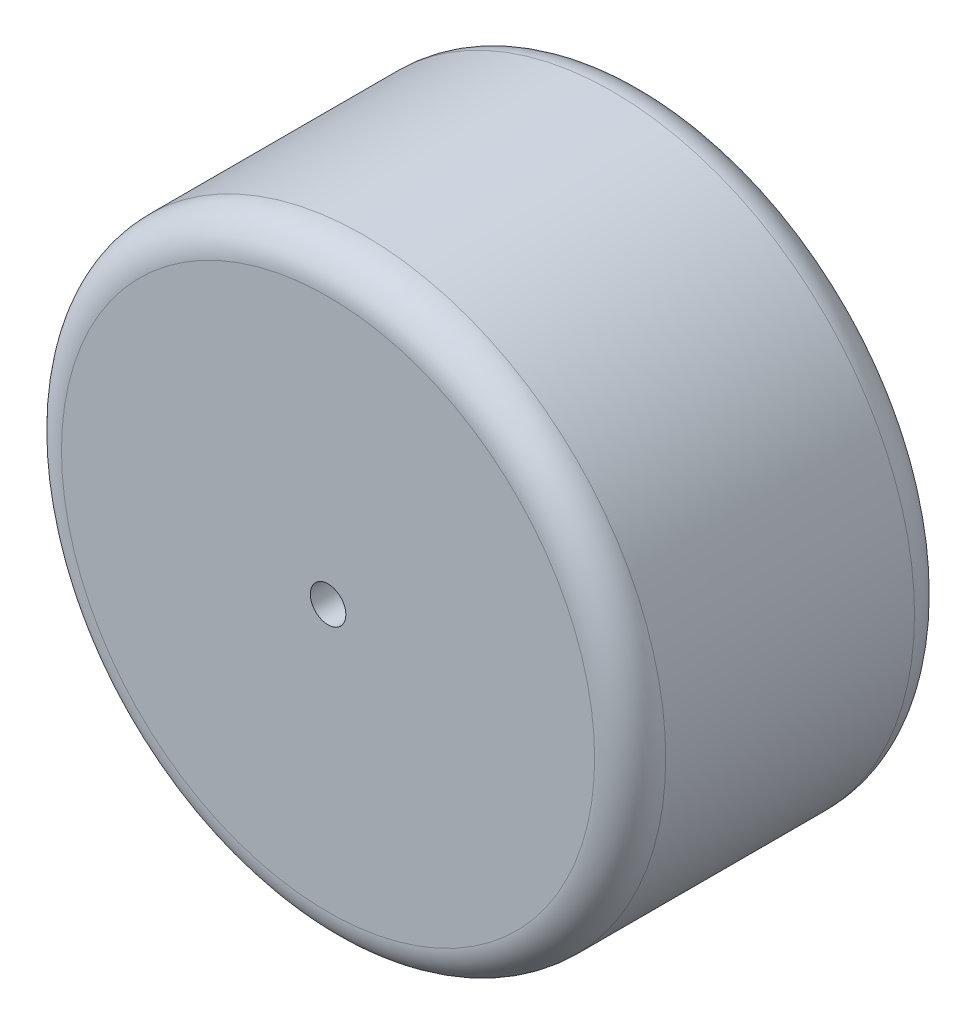
from build123d import *

# Parameters (mm, degrees)
SKETCH1_R           = 17
SKETCH1_R_2         = 1
BOSS_EXTRUDE1_DEPTH = 18
FILLET1_R           = 2


with BuildPart() as part:
    # Sketch1 → Boss-Extrude1 (new body)
    with BuildSketch(Plane.XY):
        Circle(SKETCH1_R)
        Circle(SKETCH1_R_2, mode=Mode.SUBTRACT)
    extrude(amount=BOSS_EXTRUDE1_DEPTH)

    # Fillet1
    fillet1_edges = [part.edges().sort_by_distance(p)[0] for p in [
        (-17, 0, 0),
        (-17, 0, 18),
    ]]
    fillet(fillet1_edges, radius=FILLET1_R)


solid = part.part
